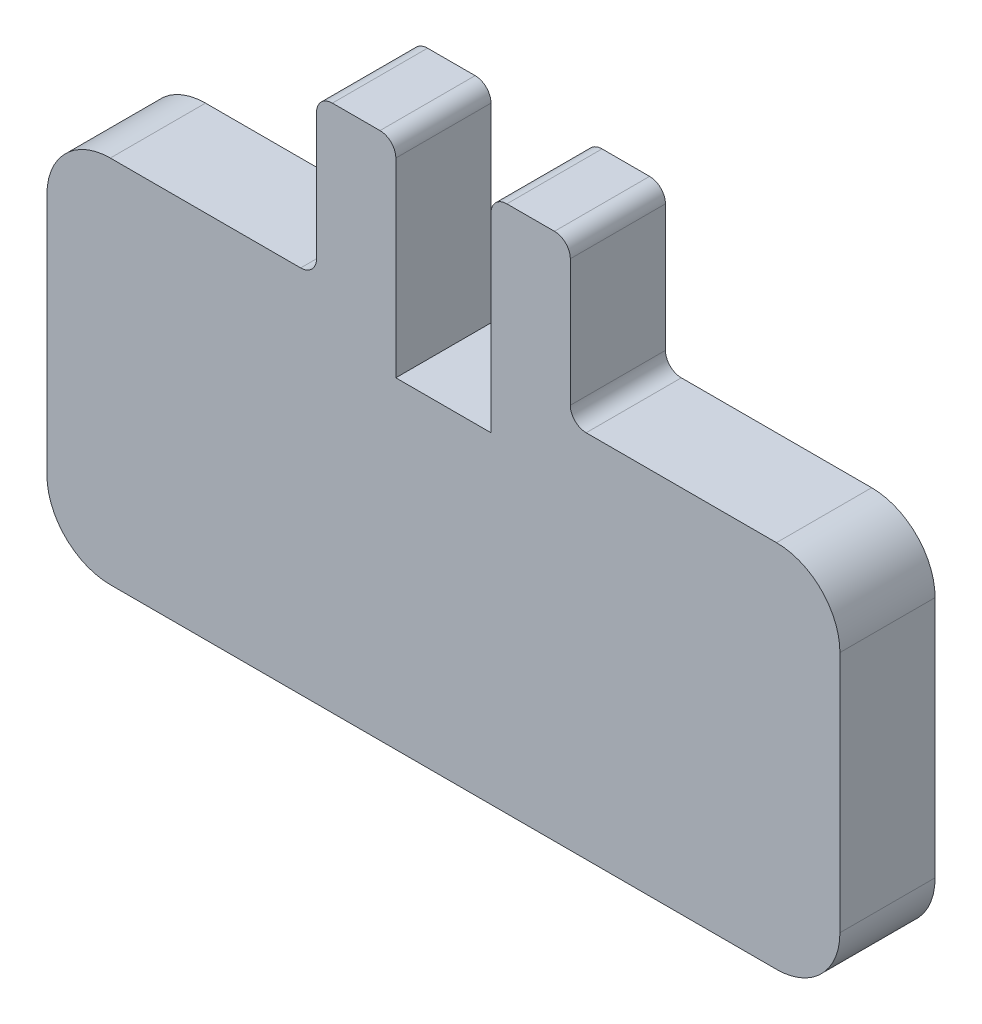
from build123d import *

# Parameters (mm, degrees)
ESQUISSE1_W             = 50
ESQUISSE1_H             = 44
BOSS_EXTRU_1_DEPTH      = 6
ESQUISSE2_W             = 6
ESQUISSE2_H             = 23.7
ESQUISSE2_W_2           = 17
ESQUISSE2_H_2           = 20.7
ENL_V_MAT_EXTRU_1_DEPTH = 6
ESQUISSE3_W             = 5
ESQUISSE3_H             = 10.7
ENL_V_MAT_EXTRU_2_DEPTH = 6
CONG_1_R                = 4
CONG_2_R                = 1


with BuildPart() as part:
    # Esquisse1 → Boss.-Extru.1 (new body)
    with BuildSketch(Plane.XY):
        with Locations((25, 22)):
            Rectangle(ESQUISSE1_W, ESQUISSE1_H)
    extrude(amount=BOSS_EXTRU_1_DEPTH)

    # Esquisse2 → Enlèv. mat.-Extru.1 (cut)
    with BuildSketch(Plane.XY.offset(6)):
        with Locations((25, 32.15)):
            Rectangle(ESQUISSE2_W, ESQUISSE2_H)
        with Locations((41.5, 33.65)):
            Rectangle(ESQUISSE2_W_2, ESQUISSE2_H_2)
        with Locations((8.5, 33.65)):
            Rectangle(ESQUISSE2_W_2, ESQUISSE2_H_2)
    extrude(amount=-ENL_V_MAT_EXTRU_1_DEPTH, mode=Mode.SUBTRACT)

    # Esquisse3 → Enlèv. mat.-Extru.2 (cut)
    with BuildSketch(Plane.XY.offset(6)):
        with Locations((19.5, 38.65)):
            Rectangle(ESQUISSE3_W, ESQUISSE3_H)
        with Locations((30.5, 38.65)):
            Rectangle(ESQUISSE3_W, ESQUISSE3_H)
    extrude(amount=-ENL_V_MAT_EXTRU_2_DEPTH, mode=Mode.SUBTRACT)

    # Congé1
    cong_1_edges = [part.edges().sort_by_distance(p)[0] for p in [
        (50, 23.3, 3),
        (0, 23.3, 3),
        (50, 0, 3),
        (0, 0, 3),
    ]]
    fillet(cong_1_edges, radius=CONG_1_R)

    # Congé2
    cong_2_edges = [part.edges().sort_by_distance(p)[0] for p in [
        (33, 23.3, 3),
        (17, 23.3, 3),
        (17, 33.3, 3),
        (22, 33.3, 3),
        (28, 33.3, 3),
        (33, 33.3, 3),
    ]]
    fillet(cong_2_edges, radius=CONG_2_R)


solid = part.part
